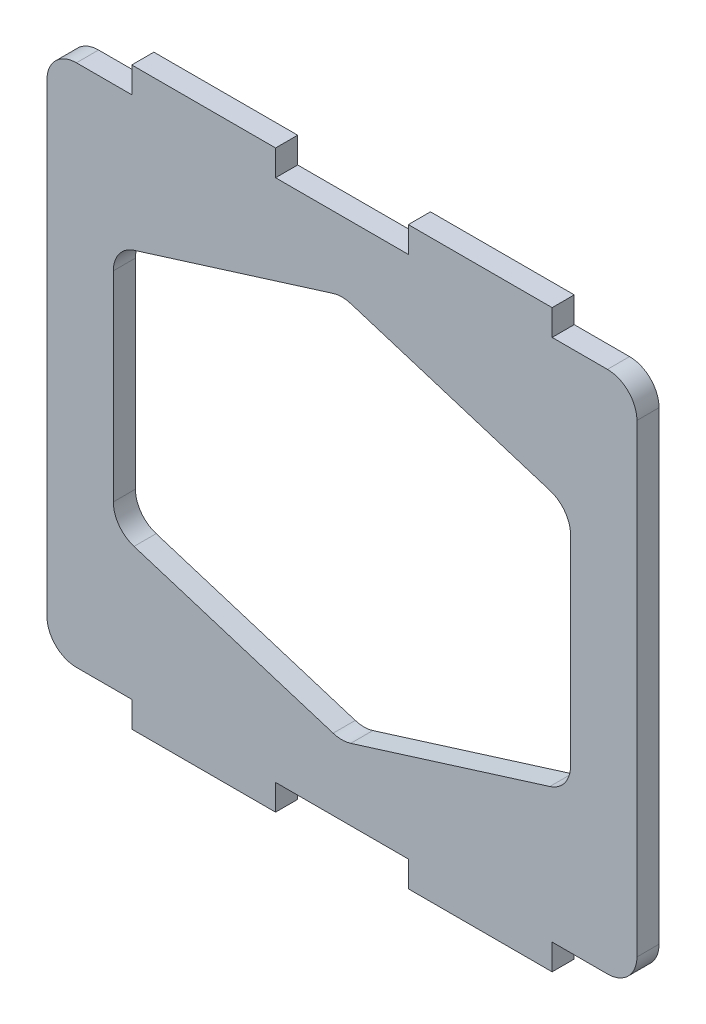
from build123d import *

# Parameters (mm, degrees)
FPV_PLATE_DEPTH = 1.5


with BuildPart() as part:
    # Sketch1 → fpv-plate (new body)
    with BuildSketch(Plane.XY):
        with BuildLine():
            Line((18, 17.75), (14.25, 17.75))
            Line((14.25, 17.75), (14.25, 19.5))
            Line((14.25, 19.5), (4.5, 19.5))
            Line((4.5, 19.5), (4.5, 17.75))
            Line((4.5, 17.75), (-4.5, 17.75))
            Line((-4.5, 17.75), (-4.5, 19.5))
            Line((-4.5, 19.5), (-14.25, 19.5))
            Line((-14.25, 19.5), (-14.25, 17.75))
            Line((-14.25, 17.75), (-18, 17.75))
            ThreePointArc((-18, 17.75), (-19.414213562, 17.164213562), (-20, 15.75))
            Line((-20, 15.75), (-20, -15.75))
            ThreePointArc((-20, -15.75), (-19.414213562, -17.164213562), (-18, -17.75))
            Line((-18, -17.75), (-14.25, -17.75))
            Line((-14.25, -17.75), (-14.25, -19.5))
            Line((-14.25, -19.5), (-4.5, -19.5))
            Line((-4.5, -19.5), (-4.5, -17.75))
            Line((-4.5, -17.75), (4.5, -17.75))
            Line((4.5, -17.75), (4.5, -19.5))
            Line((4.5, -19.5), (14.25, -19.5))
            Line((14.25, -19.5), (14.25, -17.75))
            Line((14.25, -17.75), (18, -17.75))
            ThreePointArc((18, -17.75), (19.414213562, -17.164213562), (20, -15.75))
            Line((20, -15.75), (20, 15.75))
            ThreePointArc((20, 15.75), (19.414213562, 17.164213562), (18, 17.75))
        make_face()
        with BuildLine():
            Line((-0.596130775, -12.909090909), (-14.096130775, -8.693594715))
            ThreePointArc((-14.096130775, -8.693594715), (-15.111251307, -7.96935368), (-15.5, -6.784503806))
            Line((-15.5, -6.784503806), (-15.5, 6.784503806))
            ThreePointArc((-15.5, 6.784503806), (-15.111251307, 7.96935368), (-14.096130775, 8.693594715))
            Line((-14.096130775, 8.693594715), (-0.596130775, 12.909090909))
            ThreePointArc((-0.596130775, 12.909090909), (0, 13), (0.596130775, 12.909090909))
            Line((0.596130775, 12.909090909), (14.096130775, 8.693594715))
            ThreePointArc((14.096130775, 8.693594715), (15.111251307, 7.96935368), (15.5, 6.784503806))
            Line((15.5, 6.784503806), (15.5, -6.784503806))
            ThreePointArc((15.5, -6.784503806), (15.111251307, -7.96935368), (14.096130775, -8.693594715))
            Line((14.096130775, -8.693594715), (0.596130775, -12.909090909))
            ThreePointArc((0.596130775, -12.909090909), (0, -13), (-0.596130775, -12.909090909))
        make_face(mode=Mode.SUBTRACT)
    extrude(amount=-FPV_PLATE_DEPTH)


solid = part.part
